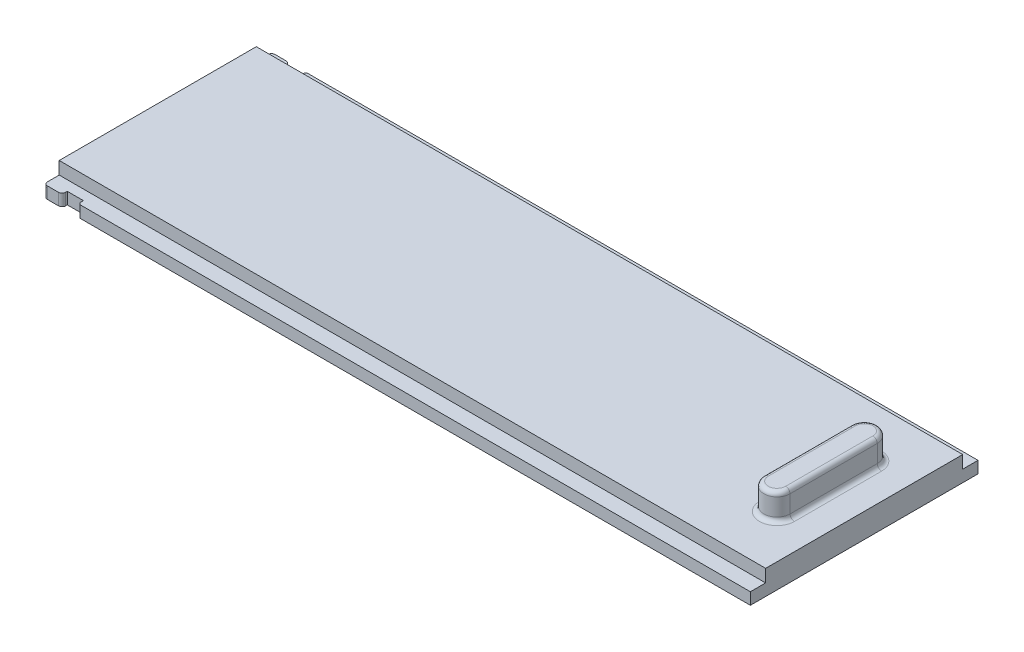
from build123d import *

# Parameters (mm, degrees)
SKETCH1_W           = 81
SKETCH1_H           = 29
BOSS_EXTRUDE1_DEPTH = 3
CUT_EXTRUDE2_DEPTH  = 81
CUT_EXTRUDE3_DEPTH  = 81
SKETCH6_W           = 1.85
SKETCH6_H           = 1.55
CUT_EXTRUDE5_DEPTH  = 0.6
FILLET6_R           = 0.4
CHAMFER2_SIZE       = 0.2
SKETCH7_W           = 1.85
SKETCH7_H           = 1.55
CUT_EXTRUDE6_DEPTH  = 0.6
FILLET7_R           = 0.4
CHAMFER3_SIZE       = 0.2
SKETCH11_W          = 81
SKETCH11_H          = 26.1
CUT_EXTRUDE7_DEPTH  = 0.2
FILLET8_R           = 0.4
BOSS_EXTRUDE2_DEPTH = 3
FILLET11_R          = 0.5
FILLET10_R          = 0.5


with BuildPart() as part:
    # Sketch1 → Boss-Extrude1 (new body)
    with BuildSketch(Plane(origin=(0, 0, 0), x_dir=(1, 0, 0), z_dir=(0, 1, 0))):
        with Locations((40.5, 14.5)):
            Rectangle(SKETCH1_W, SKETCH1_H)
    extrude(amount=BOSS_EXTRUDE1_DEPTH)

    # Sketch2 → Cut-Extrude2 (cut)
    with BuildSketch(Plane(origin=(81, 0, 0), x_dir=(0, 0, -1), z_dir=(1, 0, 0))):
        Polygon((0, 3), (3, 3), (3, 1.75), (1.25, 1.75), (1.25, 0), (0, 0), align=None)
        Polygon((29, 0), (27.75, 0), (27.75, 1.75), (26, 1.75), (26, 3), (29, 3), align=None)
    extrude(amount=-CUT_EXTRUDE2_DEPTH, mode=Mode.SUBTRACT)

    # Sketch4 → Cut-Extrude3 (cut)
    with BuildSketch(Plane(origin=(81, 0, 0), x_dir=(0, 0, -1), z_dir=(1, 0, 0))):
        Polygon((27.75, 0), (27.55, 0), (27.55, 1.55), (25.8, 1.55), (25.8, 3), (26, 3), (26, 1.75), (27.75, 1.75), align=None)
        Polygon((3.2, 3), (3, 3), (3, 1.75), (1.25, 1.75), (1.25, 0), (1.45, 0), (1.45, 1.55), (3.2, 1.55), align=None)
    extrude(amount=-CUT_EXTRUDE3_DEPTH, mode=Mode.SUBTRACT)

    # Sketch6 → Cut-Extrude5 (cut)
    with BuildSketch(Plane.XY.offset(-1.45)):
        with Locations((3, 0.775)):
            Rectangle(SKETCH6_W, SKETCH6_H)
    extrude(amount=-CUT_EXTRUDE5_DEPTH, mode=Mode.SUBTRACT)

    # Fillet6
    fillet6_edges = [part.edges().sort_by_distance(p)[0] for p in [
        (2.075, 0.775, -1.45),
    ]]
    fillet(fillet6_edges, radius=FILLET6_R)

    # Chamfer2
    chamfer2_edges = [part.edges().sort_by_distance(p)[0] for p in [
        (3.925, 0.775, -1.45),
    ]]
    chamfer(chamfer2_edges, length=CHAMFER2_SIZE)

    # Sketch7 → Cut-Extrude6 (cut)
    with BuildSketch(Plane(origin=(0, 0, -27.55), x_dir=(-1, 0, 0), z_dir=(0, 0, -1))):
        with Locations((-3, 0.775)):
            Rectangle(SKETCH7_W, SKETCH7_H)
    extrude(amount=-CUT_EXTRUDE6_DEPTH, mode=Mode.SUBTRACT)

    # Fillet7
    fillet7_edges = [part.edges().sort_by_distance(p)[0] for p in [
        (2.075, 0.775, -27.55),
    ]]
    fillet(fillet7_edges, radius=FILLET7_R)

    # Chamfer3
    chamfer3_edges = [part.edges().sort_by_distance(p)[0] for p in [
        (3.925, 0.775, -27.55),
    ]]
    chamfer(chamfer3_edges, length=CHAMFER3_SIZE)

    # Sketch11 → Cut-Extrude7 (cut)
    with BuildSketch(Plane(origin=(0, 0, 0), x_dir=(-1, 0, 0), z_dir=(0, -1, 0))):
        with Locations((-40.5, 14.5)):
            Rectangle(SKETCH11_W, SKETCH11_H)
    extrude(amount=-CUT_EXTRUDE7_DEPTH, mode=Mode.SUBTRACT)

    # Fillet8
    fillet8_edges = [part.edges().sort_by_distance(p)[0] for p in [
        (0, 0.875, -27.55),
        (0, 0.875, -1.45),
    ]]
    fillet(fillet8_edges, radius=FILLET8_R)

    # Sketch9 → Boss-Extrude2 (add)
    with BuildSketch(Plane(origin=(0, 3, 0), x_dir=(1, 0, 0), z_dir=(0, 1, 0))):
        with BuildLine():
            Line((74.5, 9.5), (74.5, 19.5))
            ThreePointArc((74.5, 19.5), (76, 21), (77.5, 19.5))
            Line((77.5, 19.5), (77.5, 9.5))
            ThreePointArc((77.5, 9.5), (76, 8), (74.5, 9.5))
        make_face()
    extrude(amount=BOSS_EXTRUDE2_DEPTH)

    # Fillet11
    fillet11_edges = [part.edges().sort_by_distance(p)[0] for p in [
        (76, 6, -8),
        (77.5, 6, -14.5),
        (76, 6, -21),
        (74.5, 6, -14.5),
    ]]
    fillet(fillet11_edges, radius=FILLET11_R)

    # Fillet10
    fillet10_edges = [part.edges().sort_by_distance(p)[0] for p in [
        (76, 3, -8),
        (77.5, 3, -14.5),
        (76, 3, -21),
        (74.5, 3, -14.5),
    ]]
    fillet(fillet10_edges, radius=FILLET10_R)


solid = part.part
